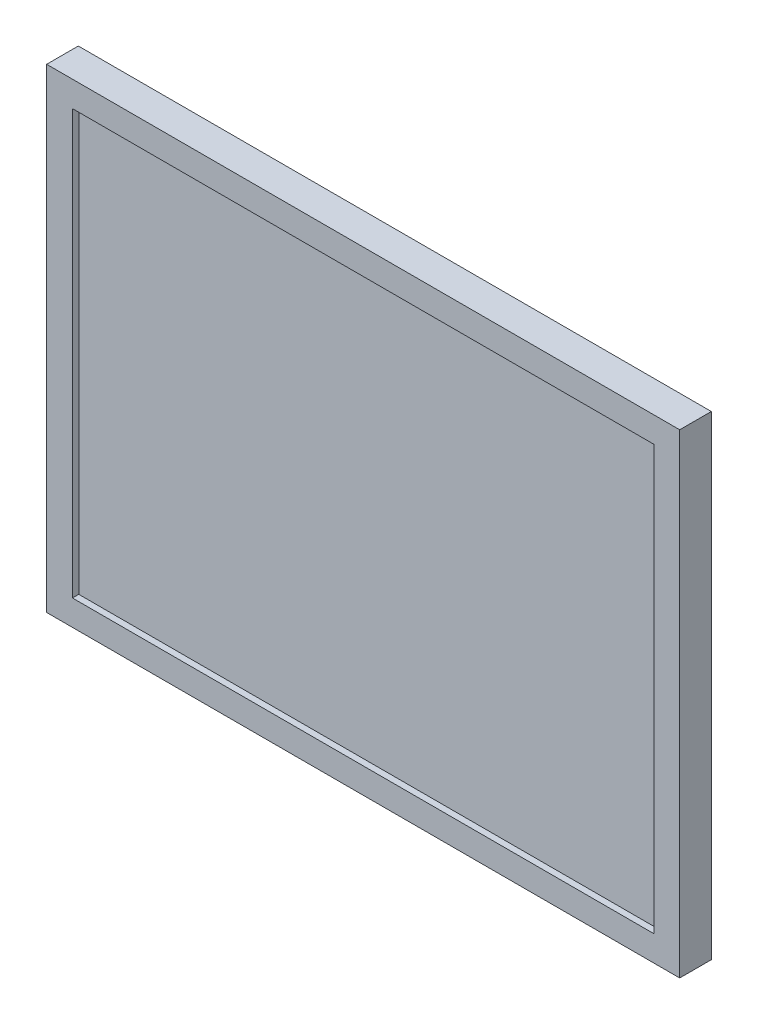
from build123d import *

# Parameters (mm, degrees)
SKETCH1_W           = 200
SKETCH1_H           = 150
BOSS_EXTRUDE1_DEPTH = 10
SKETCH2_W           = 183.702703476
SKETCH2_H           = 133.905606996
CUT_EXTRUDE1_DEPTH  = 2


with BuildPart() as part:
    # Sketch1 → Boss-Extrude1 (new body)
    with BuildSketch(Plane.XY):
        Rectangle(SKETCH1_W, SKETCH1_H)
    extrude(amount=BOSS_EXTRUDE1_DEPTH)

    # Sketch2 → Cut-Extrude1 (cut)
    with BuildSketch(Plane.XY.offset(10)):
        Rectangle(SKETCH2_W, SKETCH2_H)
    extrude(amount=-CUT_EXTRUDE1_DEPTH, mode=Mode.SUBTRACT)


solid = part.part
